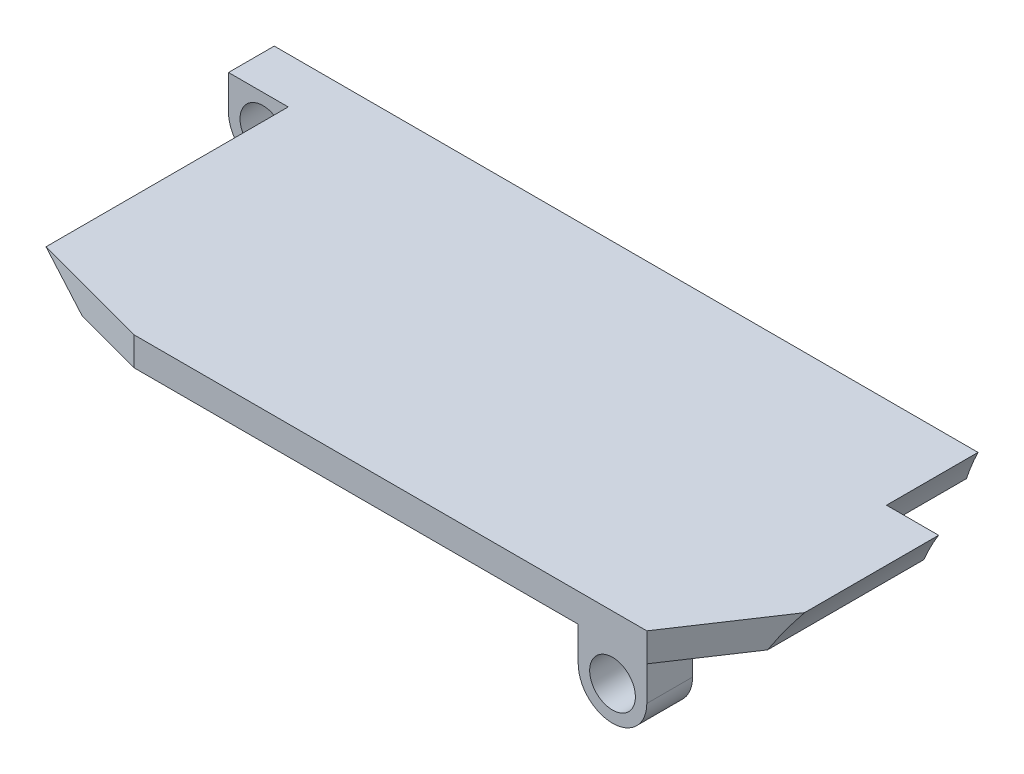
from build123d import *

# Parameters (mm, degrees)
EXTRUDE_1_DEPTH     = 14
CUT_EXTRUDE_1_DEPTH = 4
CUT_EXTRUDE_2_DEPTH = 23.370796565
EXTRUDE_2_DEPTH     = 2
EXTRUDE_3_DEPTH     = 2
MM_1_D              = 2
MM_2_D              = 2


with BuildPart() as part:
    # 草图2 → 凸台-拉伸1 (new body)
    with BuildSketch(Plane(origin=(0, 0, -2), x_dir=(-1, 0, 0), z_dir=(0, 0, -1))):
        with BuildLine():
            Line((-14.855557574, 24.75), (15.584929867, 24.75))
            Line((15.584929867, 24.75), (13.419866357, 26))
            Line((13.419866357, 26), (-14.208438024, 26))
            ThreePointArc((-14.208438024, 26), (-14.507523283, 25.36232965), (-14.855557574, 24.75))
        make_face()
    extrude(amount=EXTRUDE_1_DEPTH)

    # 草图3 → 切除-拉伸1 (cut)
    with BuildSketch(Plane(origin=(0, 0, -16), x_dir=(-1, 0, 0), z_dir=(0, 0, -1))):
        with BuildLine():
            Line((-12.578432584, 24.75), (-17.35825905, 24.75))
            Line((-17.35825905, 24.75), (-16.062803405, 32.25))
            Line((-16.062803405, 32.25), (-11.849295798, 32.25))
            ThreePointArc((-11.849295798, 32.25), (-11.55161702, 28.435617497), (-12.578432584, 24.75))
        make_face()
    extrude(amount=-CUT_EXTRUDE_1_DEPTH, mode=Mode.SUBTRACT)

    # 草图4 → 切除-拉伸2 (cut, through all)
    with BuildSketch(Plane.XZ.offset(-24.75)):
        Polygon((12.09629915, -2), (15.429632483, -7), (15.429632483, -2), align=None)
        Polygon((-10.329335075, -2), (-15.584929867, -3.40823238), (-15.584929867, -2), align=None)
    extrude(amount=-CUT_EXTRUDE_2_DEPTH, mode=Mode.SUBTRACT)

    # 草图6 → 凸台-拉伸2 (add)
    with BuildSketch(Plane(origin=(0, 0, -16), x_dir=(-1, 0, 0), z_dir=(0, 0, -1))):
        with BuildLine():
            Line((13.419866357, 26), (15.584929867, 24.75))
            Line((15.584929867, 24.75), (16.695744446, 24.75))
            ThreePointArc((16.695744446, 24.75), (15.635084274, 25.189339828), (15.195744446, 26.25))
            Line((15.195744446, 26.25), (15.085744446, 26.25))
            Line((15.085744446, 26.25), (13.419866357, 26))
        make_face()
        with BuildLine():
            ThreePointArc((15.195744446, 26.25), (15.635084274, 25.189339828), (16.695744446, 24.75))
            ThreePointArc((16.695744446, 24.75), (17.756404617, 25.189339828), (18.195744446, 26.25))
            Line((18.195744446, 26.25), (15.195744446, 26.25))
        make_face()
        with BuildLine():
            ThreePointArc((18.195744446, 26.25), (16.695744446, 27.75), (15.195744446, 26.25))
            Line((15.195744446, 26.25), (18.195744446, 26.25))
        make_face()
        with BuildLine():
            ThreePointArc((18.195744446, 26.25), (17.756404617, 25.189339828), (16.695744446, 24.75))
            Line((16.695744446, 24.75), (18.195744446, 24.75))
            Line((18.195744446, 24.75), (18.195744446, 26.25))
        make_face()
    extrude(amount=-EXTRUDE_2_DEPTH)

    # 草图7 → 凸台-拉伸3 (add)
    with BuildSketch(Plane.XY.offset(-2)):
        with BuildLine():
            Line((10.59629915, 26), (12.09629915, 26))
            Line((12.09629915, 26), (12.09629915, 27.5))
            ThreePointArc((12.09629915, 27.5), (11.656959321, 26.439339828), (10.59629915, 26))
        make_face()
        with BuildLine():
            Line((9.09629915, 26), (10.59629915, 26))
            ThreePointArc((10.59629915, 26), (9.535638978, 26.439339828), (9.09629915, 27.5))
            Line((9.09629915, 27.5), (9.09629915, 26))
        make_face()
        with BuildLine():
            ThreePointArc((10.59629915, 26), (11.656959321, 26.439339828), (12.09629915, 27.5))
            Line((12.09629915, 27.5), (9.09629915, 27.5))
            ThreePointArc((9.09629915, 27.5), (9.535638978, 26.439339828), (10.59629915, 26))
        make_face()
        with BuildLine():
            Line((9.09629915, 27.5), (12.09629915, 27.5))
            ThreePointArc((12.09629915, 27.5), (10.59629915, 29), (9.09629915, 27.5))
        make_face()
    extrude(amount=-EXTRUDE_3_DEPTH)

    # 大小mm 暗销孔1 (through all)
    with Locations(Plane(origin=(0, 0, -16), x_dir=(-1, 0, 0), z_dir=(0, 0, -1))):
        with Locations((16.691791053, 26.25)):
            Hole(MM_1_D / 2)

    # 大小mm 暗销孔2 (through all)
    with Locations(Plane.XY.offset(-2)):
        with Locations((10.59629915, 27.5)):
            Hole(MM_2_D / 2)


with BuildPart() as body_2:
    # 镜向1: mirrored copy
    add(part.part.mirror(Plane.ZX))


solid = body_2.part
